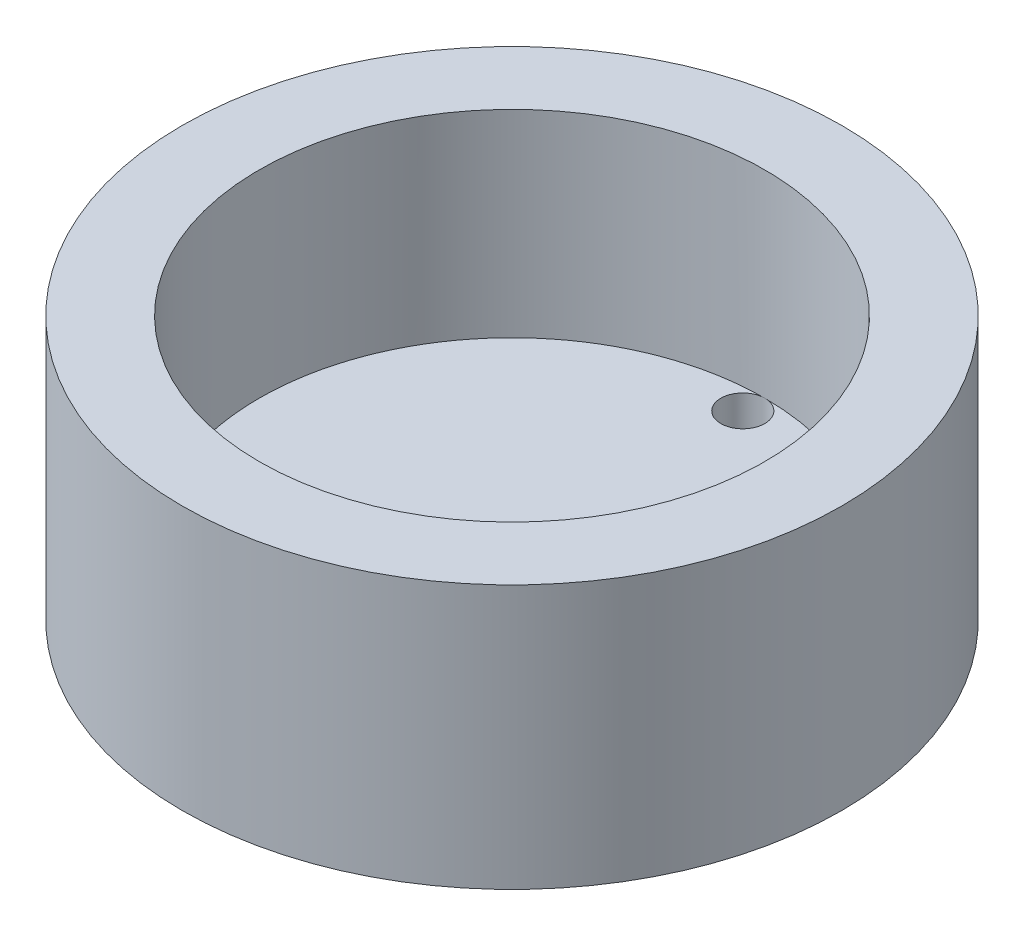
from build123d import *

# Parameters (mm, degrees)
SKETCH1_R           = 30
SKETCH1_R_2         = 23
BOSS_EXTRUDE1_DEPTH = 24
SKETCH1_2_R         = 23
BOSS_EXTRUDE2_DEPTH = 6
SKETCH2_R           = 2
CUT_EXTRUDE1_DEPTH  = 49.744230428


with BuildPart() as part:
    # Sketch1 → Boss-Extrude1 (new body)
    with BuildSketch(Plane(origin=(0, 0, 0), x_dir=(1, 0, 0), z_dir=(0, 1, 0))):
        Circle(SKETCH1_R)
        Circle(SKETCH1_R_2, mode=Mode.SUBTRACT)
    extrude(amount=BOSS_EXTRUDE1_DEPTH)

    # Sketch1<2> → Boss-Extrude2 (add)
    with BuildSketch(Plane(origin=(0, 0, 0), x_dir=(1, 0, 0), z_dir=(0, 1, 0))):
        Circle(SKETCH1_2_R)
    extrude(amount=BOSS_EXTRUDE2_DEPTH)

    # Sketch2 → Cut-Extrude1 (cut, through all)
    with BuildSketch(Plane.XZ):
        with Locations((0, 21)):
            Circle(SKETCH2_R)
        with Locations((0, -21)):
            Circle(SKETCH2_R)
    extrude(amount=-CUT_EXTRUDE1_DEPTH, mode=Mode.SUBTRACT)


solid = part.part
